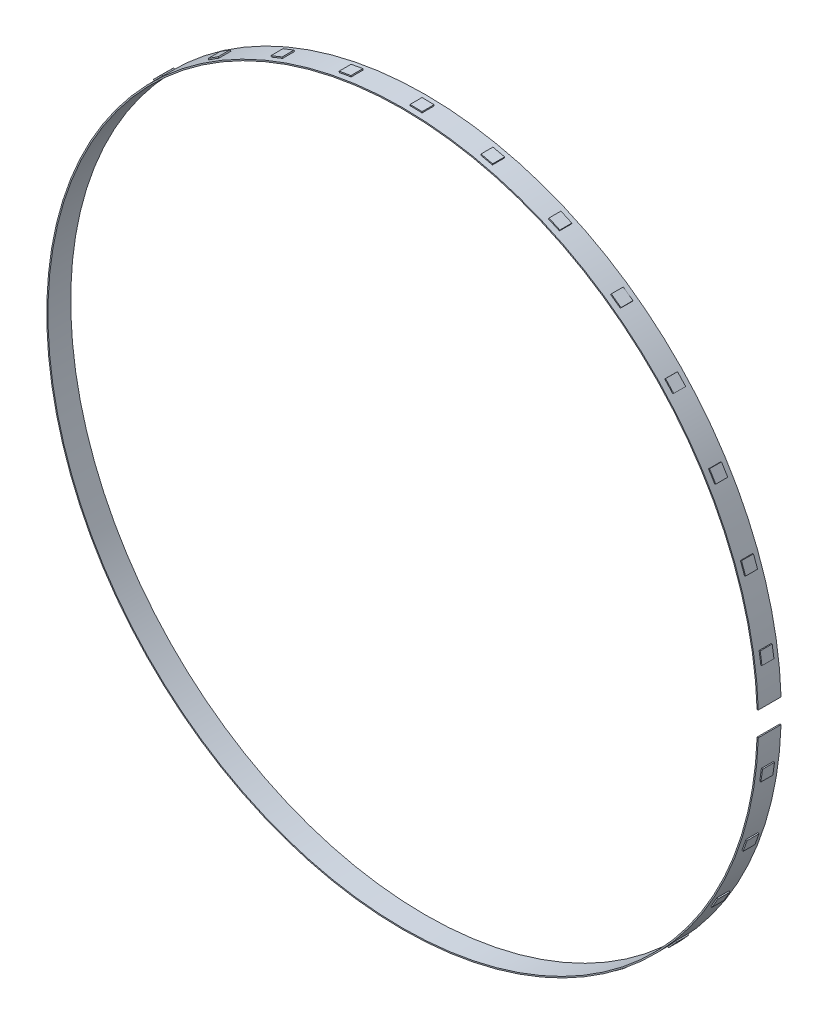
from build123d import *

# Parameters (mm, degrees)
BOSS_EXTRU_1_DEPTH           = 9.5
BOSS_EXTRU_2_DEPTH           = 5
R_P_TITION_CIRCULAIRE1_COUNT = 31
R_P_TITION_CIRCULAIRE1_ANGLE = 343.6851996


with BuildPart() as part:
    # Esquisse1 → Boss.-Extru.1 (new body)
    with BuildSketch(Plane.XY):
        with BuildLine():
            Line((148.415801046, 5), (147.915516427, 5))
            ThreePointArc((147.915516427, 5), (-148, 0), (147.915516427, -5))
            Line((147.915516427, -5), (148.415801046, -5))
            ThreePointArc((148.415801046, -5), (-148.5, 0), (148.415801046, 5))
        make_face()
    extrude(amount=BOSS_EXTRU_1_DEPTH)

    # Esquisse2 → Boss.-Extru.2 (add)
    with BuildSketch(Plane.XY.offset(2.25)):
        Polygon((146.960409873, 24.517699499), (147.700328689, 19.572750546), (147.214129757, 19.5), (146.474210941, 24.444948953), align=None)
    boss_extru_2 = extrude(amount=BOSS_EXTRU_2_DEPTH)

    # Répétition circulaire1: Boss.-Extru.2 ×31 about axis
    r_p_tition_circulaire1_axis = Axis((0, 0, 0), (0, 0, 1))
    for i in range(1, R_P_TITION_CIRCULAIRE1_COUNT):
        add(boss_extru_2.rotate(r_p_tition_circulaire1_axis, i * R_P_TITION_CIRCULAIRE1_ANGLE / (R_P_TITION_CIRCULAIRE1_COUNT - 1)))


solid = part.part
